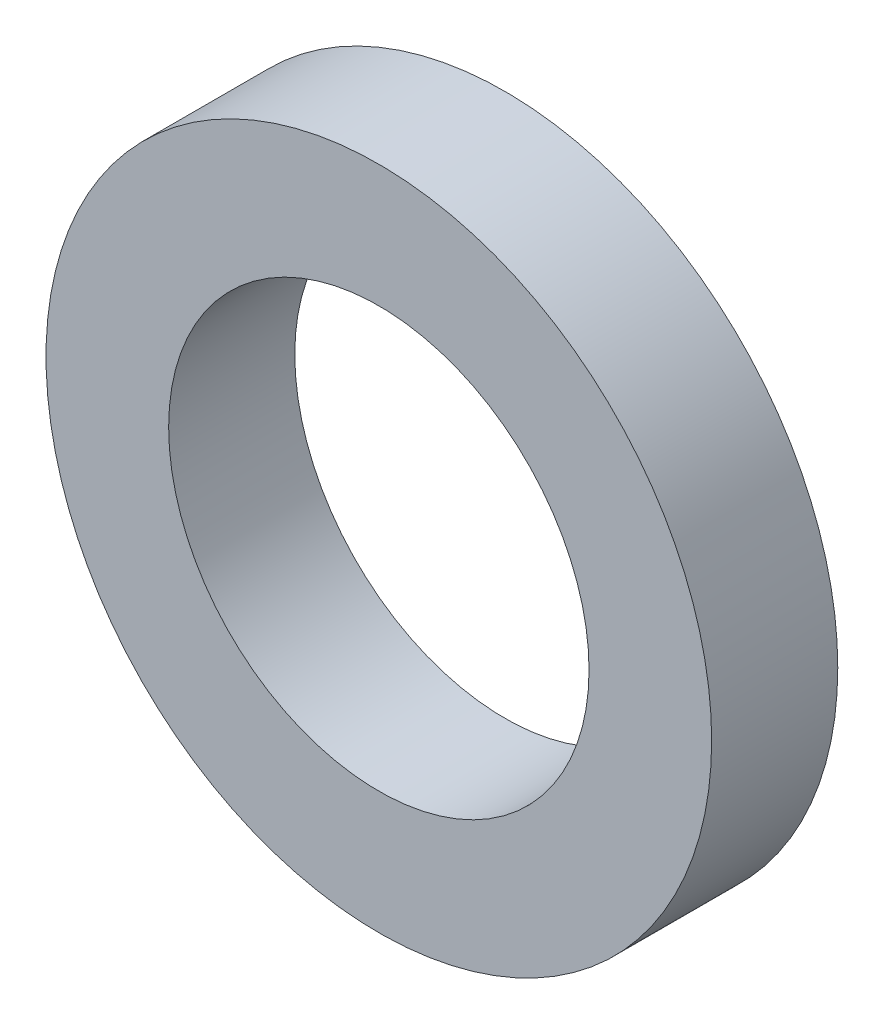
from build123d import *

# Parameters (mm, degrees)
SKIZZE1_R                       = 47.5
SKIZZE1_R_2                     = 30
AUFSATZ_LINEAR_AUSTRAGEN1_DEPTH = 18


with BuildPart() as part:
    # Skizze1 → Aufsatz-Linear austragen1 (new body)
    with BuildSketch(Plane.XY):
        Circle(SKIZZE1_R)
        Circle(SKIZZE1_R_2, mode=Mode.SUBTRACT)
    extrude(amount=AUFSATZ_LINEAR_AUSTRAGEN1_DEPTH)


solid = part.part
